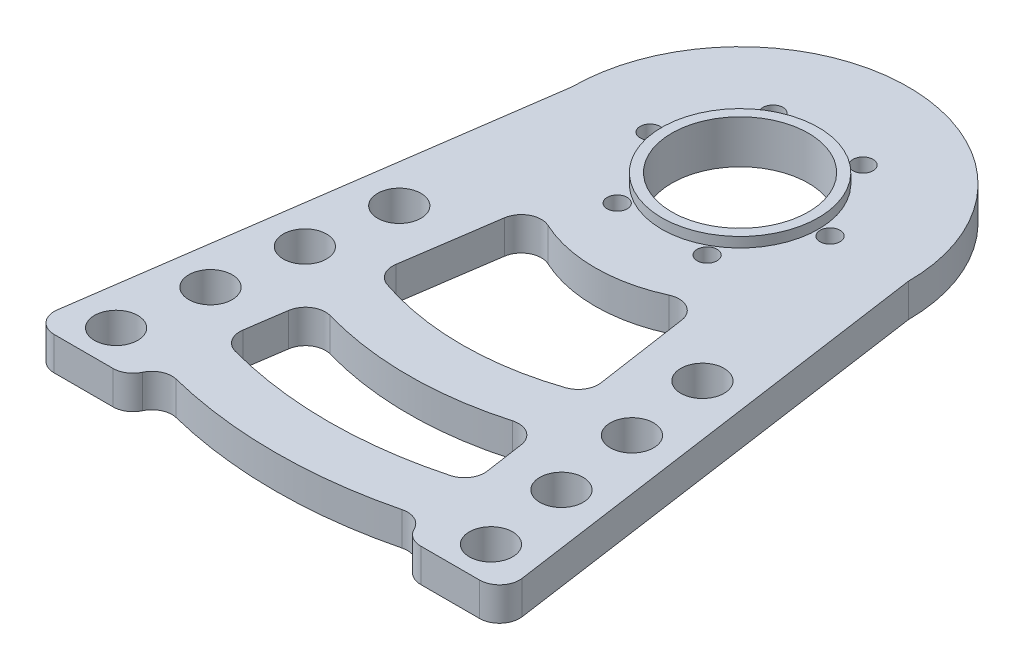
from build123d import *

# Parameters (mm, degrees)
SKETCH1_R           = 29
SKETCH1_R_2         = 2.25
SKETCH1_R_3         = 10.25
BOSS_EXTRUDE1_DEPTH = 5
SKETCH4_R           = 11.75
SKETCH4_R_2         = 10.25
BOSS_EXTRUDE2_DEPTH = 1.5
SKETCH12_R          = 3.25
CUT_EXTRUDE5_DEPTH  = 5
SKETCH13_W          = 118.6352657
SKETCH13_H          = 76.236501847
CUT_EXTRUDE6_DEPTH  = 5
CUT_EXTRUDE7_DEPTH  = 5
FILLET2_R           = 3
SKETCH15_R          = 1.5
CUT_EXTRUDE8_DEPTH  = 10
CIRPATTERN1_COUNT   = 6
BOSS_EXTRUDE3_DEPTH = 5
FILLET3_R           = 3


with BuildPart() as part:
    # Sketch1 → Boss-Extrude1 (new body)
    with BuildSketch(Plane(origin=(0, 0, 0), x_dir=(1, 0, 0), z_dir=(0, 1, 0))):
        with BuildLine():
            Line((39.5, 0), (25.25, 100))
            ThreePointArc((25.25, 100), (0, 125.25), (-25.25, 100))
            Line((-25.25, 100), (-39.5, 0))
            ThreePointArc((-39.5, 0), (0, -39.5), (39.5, 0))
        make_face()
        with Locations(Location((0, 0, 0), (0, 0, 270))):
            Circle(SKETCH1_R, mode=Mode.SUBTRACT)
        with Locations(Location((33, 0, 0), (0, 0, 270))):
            Circle(SKETCH1_R_2, mode=Mode.SUBTRACT)
        with Locations(Location((16.5, -28.578838325, 0), (0, 0, 270))):
            Circle(SKETCH1_R_2, mode=Mode.SUBTRACT)
        with Locations(Location((-16.5, -28.578838325, 0), (0, 0, 270))):
            Circle(SKETCH1_R_2, mode=Mode.SUBTRACT)
        with Locations(Location((-33, 0, 0), (0, 0, 270))):
            Circle(SKETCH1_R_2, mode=Mode.SUBTRACT)
        with Locations(Location((0, 100, 0), (0, 0, 270))):
            Circle(SKETCH1_R_3, mode=Mode.SUBTRACT)
    extrude(amount=BOSS_EXTRUDE1_DEPTH)

    # Sketch4 → Boss-Extrude2 (add)
    with BuildSketch(Plane(origin=(0, 5, 0), x_dir=(1, 0, 0), z_dir=(0, 1, 0))):
        with Locations(Location((0, 100, 0), (0, 0, 270))):
            Circle(SKETCH4_R)
        with Locations(Location((0, 100, 0), (0, 0, 270))):
            Circle(SKETCH4_R_2, mode=Mode.SUBTRACT)
    extrude(amount=BOSS_EXTRUDE2_DEPTH)

    # Sketch12 → Cut-Extrude5 (cut)
    with BuildSketch(Plane(origin=(0, 5, 0), x_dir=(1, 0, 0), z_dir=(0, 1, 0))):
        with Locations(Location((28.125255984, 34.496453628, 0), (0, 0, 270))):
            Circle(SKETCH12_R)
        with Locations(Location((26.331961895, 46.867148689, 0), (0, 0, 270))):
            Circle(SKETCH12_R)
        with Locations(Location((24.538667806, 59.237843751, 0), (0, 0, 270))):
            Circle(SKETCH12_R)
        with Locations(Location((22.745373716, 71.608538813, 0), (0, 0, 270))):
            Circle(SKETCH12_R)
    cut_extrude5 = extrude(amount=-CUT_EXTRUDE5_DEPTH, mode=Mode.SUBTRACT)

    # Mirror1: Cut-Extrude5 across plane
    add(cut_extrude5.mirror(Plane(origin=(0, 0, 0), x_dir=(0, 0, 1), z_dir=(1, 0, 0))), mode=Mode.SUBTRACT)

    # Sketch13 → Cut-Extrude6 (cut)
    with BuildSketch(Plane(origin=(0, 5, 0), x_dir=(1, 0, 0), z_dir=(0, 1, 0))):
        with Locations((0, -9.118250923)):
            Rectangle(SKETCH13_W, SKETCH13_H)
    extrude(amount=-CUT_EXTRUDE6_DEPTH, mode=Mode.SUBTRACT)

    # Sketch14 → Cut-Extrude7 (cut)
    with BuildSketch(Plane(origin=(0, 5, 0), x_dir=(1, 0, 0), z_dir=(0, 1, 0))):
        with BuildLine():
            Line((-20.500628763, 29), (20.500628763, 29))
            Line((20.500628763, 29), (12.654649355, 82.31038865))
            ThreePointArc((12.654649355, 82.31038865), (0, 78.25), (-12.654649355, 82.31038865))
            Line((-12.654649355, 82.31038865), (-20.500628763, 29))
        make_face()
    extrude(amount=-CUT_EXTRUDE7_DEPTH, mode=Mode.SUBTRACT)

    # Fillet2
    fillet2_edges = [part.edges().sort_by_distance(p)[0] for p in [
        (-20.500628763, 2.5, -29),
        (-12.654649355, 2.5, -82.31038865),
        (12.654649355, 2.5, -82.31038865),
        (20.500628763, 2.5, -29),
        (35.3675, 2.5, -29),
        (-35.3675, 2.5, -29),
    ]]
    fillet(fillet2_edges, radius=FILLET2_R)

    # Sketch15 → Cut-Extrude8 (cut)
    with BuildSketch(Plane.XZ):
        with Locations(Location((13.5, -100, 0), (0, 0, 270))):
            Circle(SKETCH15_R)
    cut_extrude8 = extrude(amount=-CUT_EXTRUDE8_DEPTH, mode=Mode.SUBTRACT)

    # CirPattern1: Cut-Extrude8 ×6 about axis
    cirpattern1_axis = Axis((0, 0, -100), (0, 1, 0))
    for i in range(1, CIRPATTERN1_COUNT):
        add(cut_extrude8.rotate(cirpattern1_axis, i * 360 / CIRPATTERN1_COUNT), mode=Mode.SUBTRACT)

    # Sketch16 → Boss-Extrude3 (add)
    with BuildSketch(Plane(origin=(0, 5, 0), x_dir=(1, 0, 0), z_dir=(0, 1, 0))):
        with BuildLine():
            ThreePointArc((-19.8904137, 33.146174808), (0, 30.25), (19.8904137, 33.146174808))
            Line((19.8904137, 33.146174808), (18.711950722, 41.153373927))
            ThreePointArc((18.711950722, 41.153373927), (0, 38.25), (-18.711950722, 41.153373927))
            Line((-18.711950722, 41.153373927), (-19.8904137, 33.146174808))
        make_face()
        with BuildLine():
            ThreePointArc((-16.935837694, 53.221373453), (0, 50.25), (16.935837694, 53.221373453))
            Line((16.935837694, 53.221373453), (15.742211816, 61.331598596))
            ThreePointArc((15.742211816, 61.331598596), (0, 58.25), (-15.742211816, 61.331598596))
            Line((-15.742211816, 61.331598596), (-16.935837694, 53.221373453))
        make_face()
    extrude(amount=-BOSS_EXTRUDE3_DEPTH)

    # Fillet3
    fillet3_edges = [part.edges().sort_by_distance(p)[0] for p in [
        (-15.742211816, 2.5, -61.331598596),
        (15.742211816, 2.5, -61.331598596),
        (16.935837694, 2.5, -53.221373453),
        (18.711950722, 2.5, -41.153373927),
        (-18.711950722, 2.5, -41.153373927),
        (19.8904137, 2.5, -33.146174808),
        (-16.935837694, 2.5, -53.221373453),
        (-19.8904137, 2.5, -33.146174808),
    ]]
    fillet(fillet3_edges, radius=FILLET3_R)


solid = part.part
